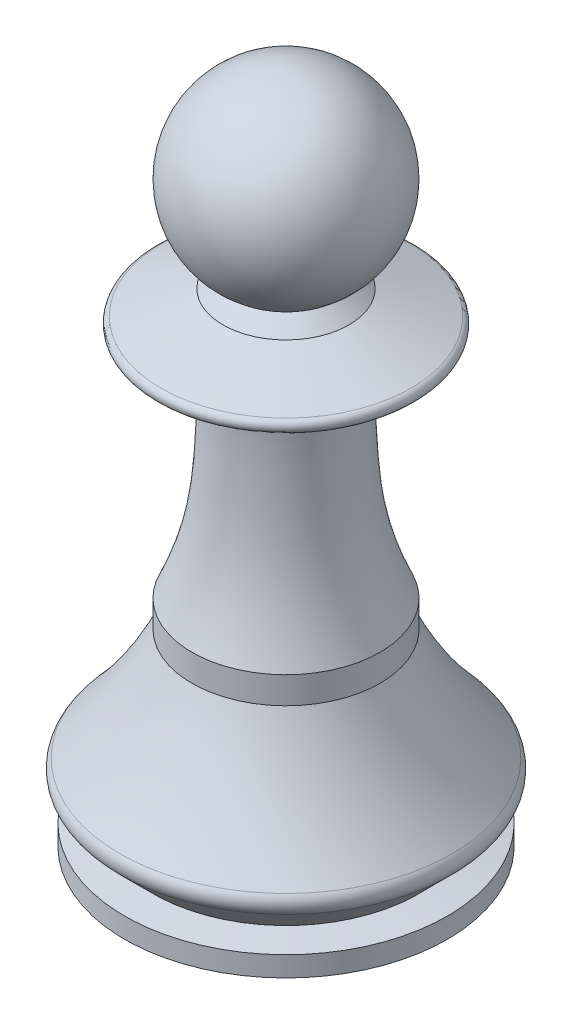
from build123d import *

# Parameters (mm, degrees)
FILLET1_R = 1
FILLET2_R = 0.5


with BuildPart() as part:
    # Sketch6 → Revolve1 (revolve)
    with BuildSketch(Plane.XY, mode=Mode.PRIVATE) as revolve1_sk:
        with BuildLine():
            Line((0, 0), (0, 50))
            ThreePointArc((0, 50), (6.761480784, 44.811733316), (3.5, 36.937822174))
            Line((3.5, 36.937822174), (4.691753593, 35.937822174))
            Line((4.691753593, 35.937822174), (11, 33.5))
            Line((11, 33.5), (5, 32.5))
            add(Edge.make_bspline(
                [(5, 32.5), (4.632564302, 30.36024899), (4.760089012, 24.410473988), (5.30369794, 19.869322034), (7, 16)],
                knots=[0, 0, 0, 0, 0.393038289, 1, 1, 1, 1], degree=3))
            Line((7, 16), (7, 14))
            add(Edge.make_bspline(
                [(7, 14), (9.178761671, 9.005043315), (13, 5)],
                knots=[0, 0, 0, 1, 1, 1], degree=2))
            Line((13, 5), (9.874740577, 1.874740577))
            Line((9.874740577, 1.874740577), (12, 1.5))
            Line((12, 1.5), (12, 0))
            Line((12, 0), (0, 0))
        make_face()
    revolve(revolve1_sk.sketch.rotate(Axis((0, 0, 0), (0, 1, 0)), 90), axis=Axis((0, 0, 0), (0, 1, 0)))

    # Fillet1
    fillet1_edges = [part.edges().sort_by_distance(p)[0] for p in [
        (0, 5, 13),
    ]]
    fillet(fillet1_edges, radius=FILLET1_R)

    # Fillet2
    fillet2_edges = [part.edges().sort_by_distance(p)[0] for p in [
        (0, 33.5, 11),
    ]]
    fillet(fillet2_edges, radius=FILLET2_R)


solid = part.part
